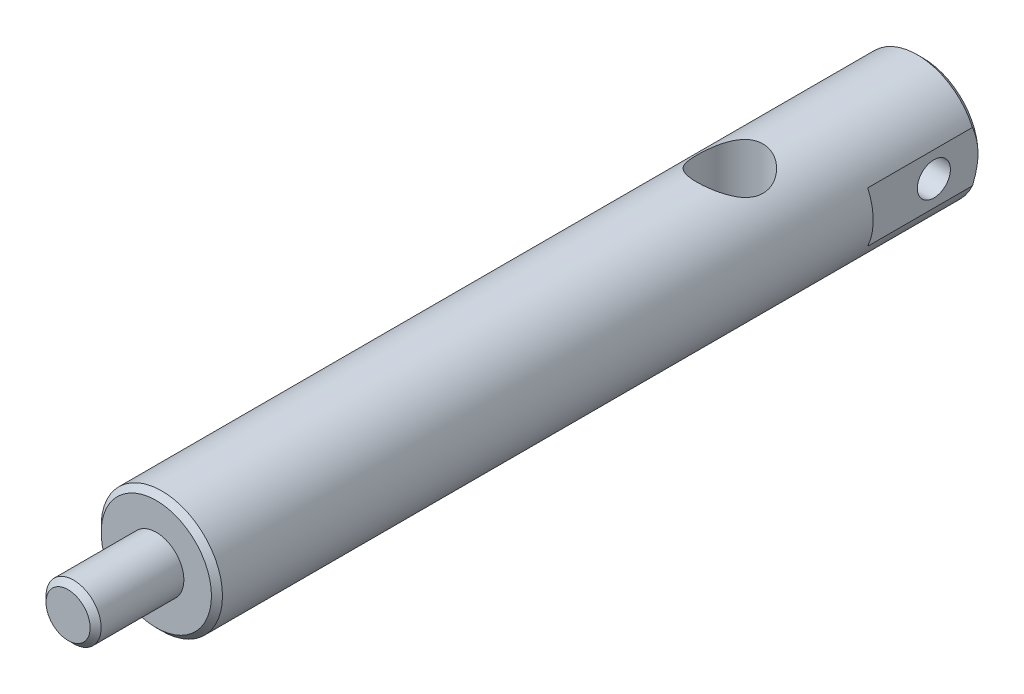
from build123d import *

# Parameters (mm, degrees)
SKETCH_1_R          = 5.5
EXTRUDE_1_DEPTH     = 69.5
CHAMFER_1_SIZE      = 0.5
SKETCH_2_R          = 2.5
EXTRUDE_2_DEPTH     = 8
CHAMFER_2_SIZE      = 0.5
SKETCH_5_R          = 1.5
CUT_EXTRUDE_3_DEPTH = 7.5
SKETCH_6_R          = 3
CUT_EXTRUDE_4_DEPTH = 7.5
SKETCH_7_W          = 2
SKETCH_7_H          = 10
CUT_EXTRUDE_5_DEPTH = 10


with BuildPart() as part:
    # 草图1 → 拉伸1 (new body)
    with BuildSketch(Plane.XY):
        Circle(SKETCH_1_R)
    extrude(amount=EXTRUDE_1_DEPTH)

    # 倒角1
    chamfer_1_edges = [part.edges().sort_by_distance(p)[0] for p in [
        (-5.5, 0, 0),
        (-5.5, 0, 69.5),
    ]]
    chamfer(chamfer_1_edges, length=CHAMFER_1_SIZE)

    # 草图2 → 拉伸2 (add)
    with BuildSketch(Plane.XY.offset(69.5)):
        Circle(SKETCH_2_R)
    extrude(amount=EXTRUDE_2_DEPTH)

    # 倒角2
    chamfer_2_edges = [part.edges().sort_by_distance(p)[0] for p in [
        (-2.5, 0, 77.5),
    ]]
    chamfer(chamfer_2_edges, length=CHAMFER_2_SIZE)

    # 草图5 → 拉伸3 (cut, symmetric)
    with BuildSketch(Plane(origin=(0, 0, 0), x_dir=(0, 0, -1), z_dir=(1, 0, 0))):
        with Locations(Location((-4, 0, 0), (0, 0, 180))):
            Circle(SKETCH_5_R)
    extrude(amount=CUT_EXTRUDE_3_DEPTH, both=True, mode=Mode.SUBTRACT)

    # 草图6 → 拉伸4 (cut, symmetric)
    with BuildSketch(Plane(origin=(0, 0, 0), x_dir=(1, 0, 0), z_dir=(0, 1, 0))):
        with Locations(Location((0, -17.5, 0), (0, 0, 270))):
            Circle(SKETCH_6_R)
    extrude(amount=CUT_EXTRUDE_4_DEPTH, both=True, mode=Mode.SUBTRACT)

    # 草图7 → 拉伸5 (cut)
    with BuildSketch(Plane.XY):
        with Locations((6, 0)):
            Rectangle(SKETCH_7_W, SKETCH_7_H)
    cut_extrude_5 = extrude(amount=CUT_EXTRUDE_5_DEPTH, mode=Mode.SUBTRACT)

    # 镜向1: 拉伸5 across plane
    add(cut_extrude_5.mirror(Plane(origin=(0, 0, 0), x_dir=(0, 0, 1), z_dir=(1, 0, 0))), mode=Mode.SUBTRACT)


solid = part.part
